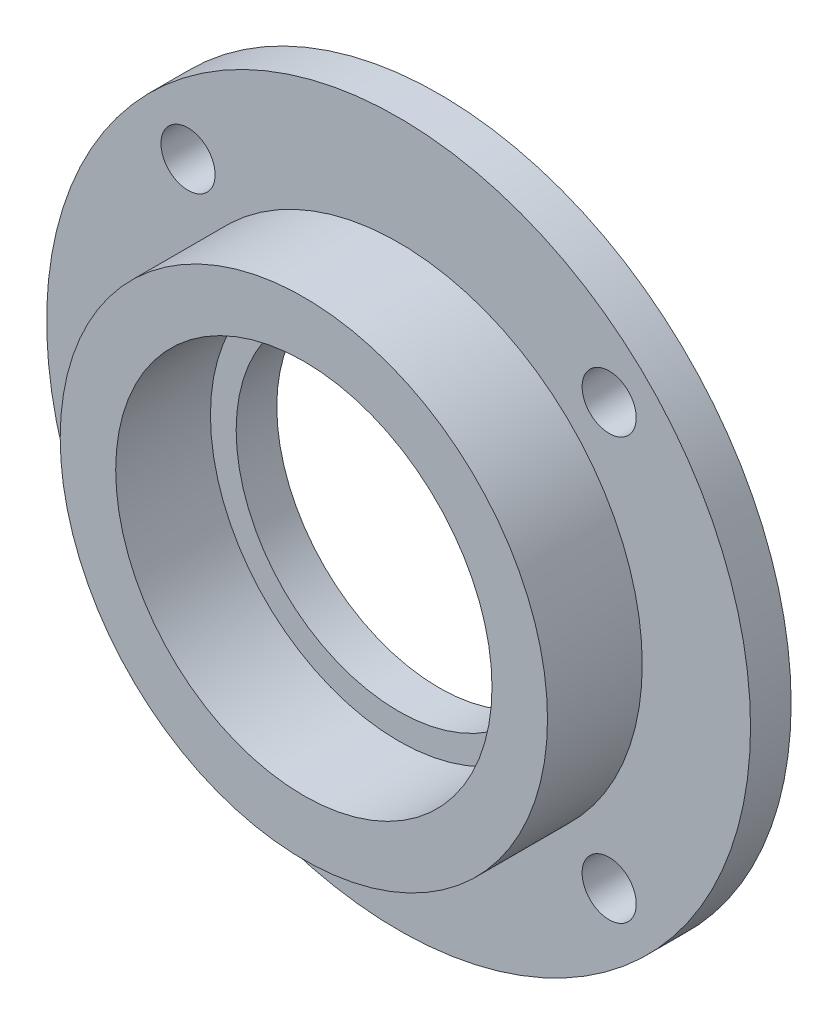
from build123d import *

# Parameters (mm, degrees)
SKETCH_1_R      = 26
SKETCH_1_R_2    = 12
SKETCH_1_R_3    = 2
EXTRUDE_1_DEPTH = 3
SKETCH_2_R      = 18
SKETCH_2_R_2    = 13.9
EXTRUDE_2_DEPTH = 7


with BuildPart() as part:
    # 草图1 → 凸台-拉伸1 (new body)
    with BuildSketch(Plane.XY):
        Circle(SKETCH_1_R)
        Circle(SKETCH_1_R_2, mode=Mode.SUBTRACT)
        with Locations((-15.556349186, 15.556349186)):
            Circle(SKETCH_1_R_3, mode=Mode.SUBTRACT)
        with Locations((15.556349186, 15.556349186)):
            Circle(SKETCH_1_R_3, mode=Mode.SUBTRACT)
        with Locations((15.556349186, -15.556349186)):
            Circle(SKETCH_1_R_3, mode=Mode.SUBTRACT)
        with Locations((-15.556349186, -15.556349186)):
            Circle(SKETCH_1_R_3, mode=Mode.SUBTRACT)
    extrude(amount=EXTRUDE_1_DEPTH)

    # 草图2 → 凸台-拉伸2 (add)
    with BuildSketch(Plane.XY.offset(3)):
        Circle(SKETCH_2_R)
        Circle(SKETCH_2_R_2, mode=Mode.SUBTRACT)
    extrude(amount=EXTRUDE_2_DEPTH)


solid = part.part
